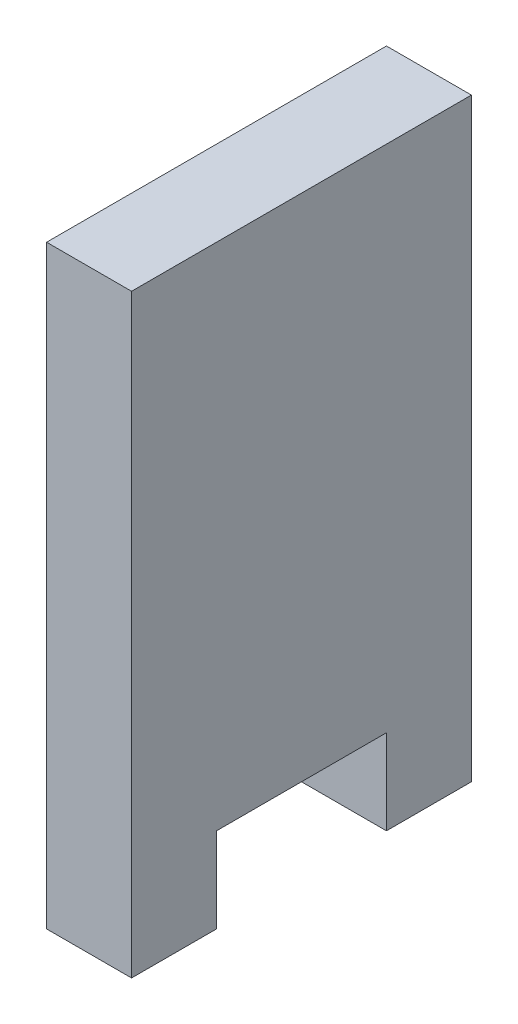
from build123d import *

# Parameters (mm, degrees)
SKETCH1_W           = 6.35
SKETCH1_H           = 6.35
BOSS_EXTRUDE1_DEPTH = 6.35


with BuildPart() as part:
    # Sketch1 → Boss-Extrude1 (new body)
    with BuildSketch(Plane(origin=(0, 0, 0), x_dir=(0, 0, -1), z_dir=(1, 0, 0))):
        Polygon((-12.7, -12.7), (-12.7, -19.05), (-6.35, -19.05), (6.35, -19.05), (12.7, -19.05), (12.7, 19.05), (-12.7, 19.05), align=None)
        with Locations((-9.525, -22.225)):
            Rectangle(SKETCH1_W, SKETCH1_H)
        with Locations((9.525, -22.225)):
            Rectangle(SKETCH1_W, SKETCH1_H)
    extrude(amount=BOSS_EXTRUDE1_DEPTH)


solid = part.part
